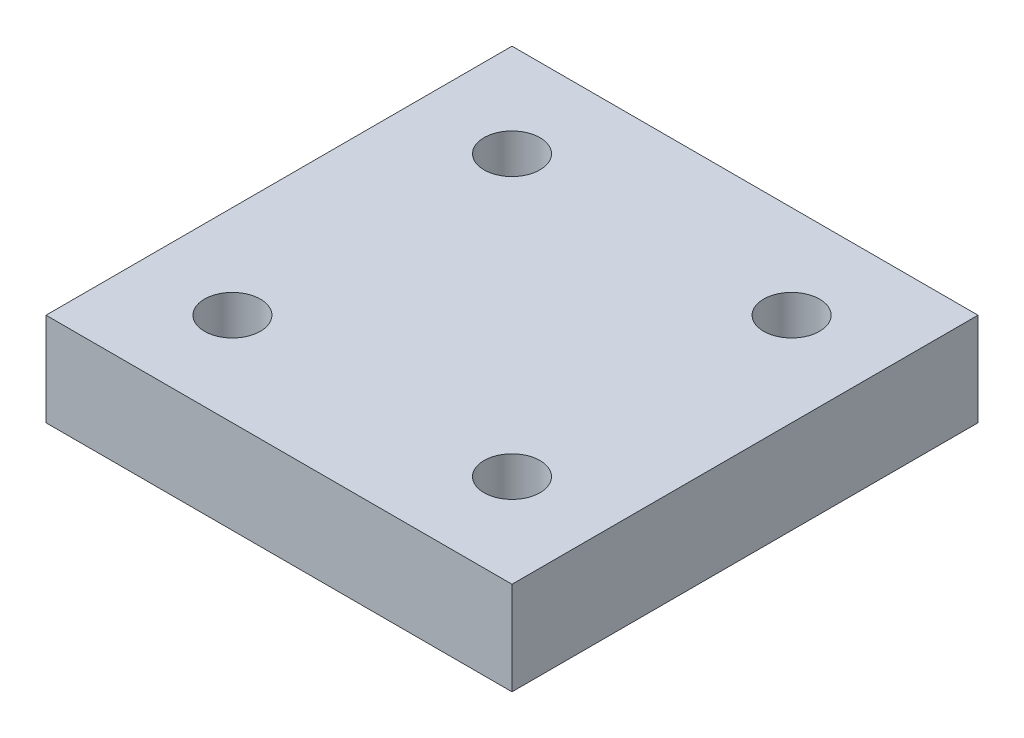
from build123d import *

# Parameters (mm, degrees)
SKETCH1_W           = 50
SKETCH1_H           = 50
SKETCH1_R           = 3
BOSS_EXTRUDE1_DEPTH = 10


with BuildPart() as part:
    # Sketch1 → Boss-Extrude1 (new body)
    with BuildSketch(Plane(origin=(0, 0, 0), x_dir=(1, 0, 0), z_dir=(0, 1, 0))):
        Rectangle(SKETCH1_W, SKETCH1_H)
        with Locations(Location((-15, 15, 0), (0, 0, 270))):
            Circle(SKETCH1_R, mode=Mode.SUBTRACT)
        with Locations(Location((15, 15, 0), (0, 0, 270))):
            Circle(SKETCH1_R, mode=Mode.SUBTRACT)
        with Locations(Location((15, -15, 0), (0, 0, 270))):
            Circle(SKETCH1_R, mode=Mode.SUBTRACT)
        with Locations(Location((-15, -15, 0), (0, 0, 270))):
            Circle(SKETCH1_R, mode=Mode.SUBTRACT)
    extrude(amount=BOSS_EXTRUDE1_DEPTH)


solid = part.part
